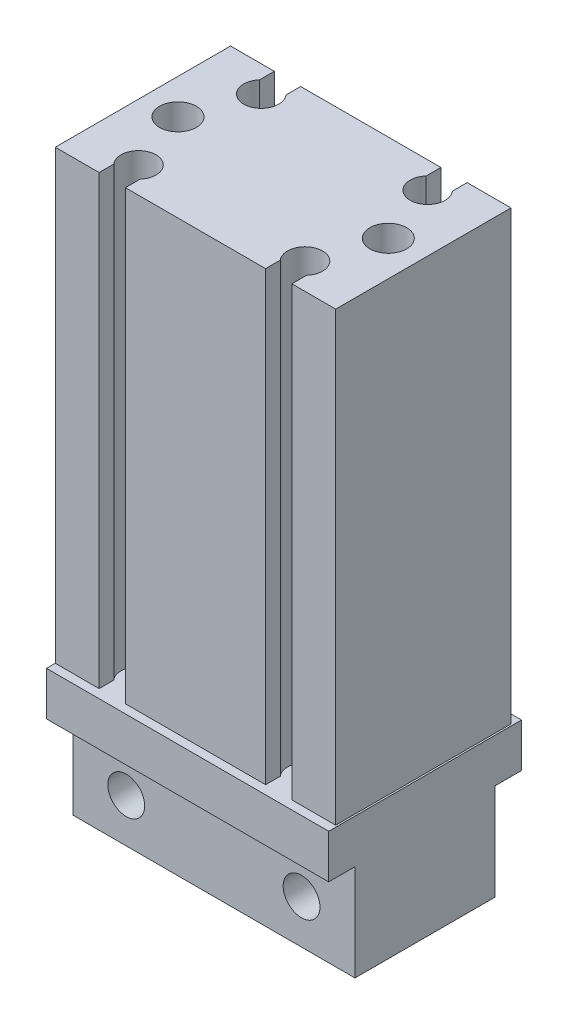
from build123d import *

# Parameters (mm, degrees)
EXTRUDE_1_DEPTH     = 51
EXTRUDE_2_DEPTH     = 32.2
SKETCH_5_R          = 7
CUT_EXTRUDE_3_DEPTH = 4
SKETCH_7_R          = 1.5
CUT_EXTRUDE_4_DEPTH = 8
SKETCH_8_R          = 2.5
CUT_EXTRUDE_5_DEPTH = 50
SKETCH_9_R          = 2.1
CUT_EXTRUDE_6_DEPTH = 57.784152719
SKETCH_10_R         = 2.1
CUT_EXTRUDE_7_DEPTH = 12
SKETCH_11_R         = 2.1
CUT_EXTRUDE_8_DEPTH = 6


with BuildPart() as part:
    # 草图1 → 拉伸1 (new body)
    with BuildSketch(Plane(origin=(0, 0, 0), x_dir=(1, 0, 0), z_dir=(0, 1, 0))):
        with BuildLine():
            Line((-16, -10), (-11, -10))
            Line((-11, -10), (-11, -8.322875656))
            ThreePointArc((-11, -8.322875656), (-9.5, -5), (-8, -8.322875656))
            Line((-8, -8.322875656), (-8, -10))
            Line((-8, -10), (8, -10))
            Line((8, -10), (8, -8.322875656))
            ThreePointArc((8, -8.322875656), (9.5, -5), (11, -8.322875656))
            Line((11, -8.322875656), (11, -10))
            Line((11, -10), (16, -10))
            Line((16, -10), (16, 10))
            Line((16, 10), (11, 10))
            Line((11, 10), (11, 8.322875656))
            ThreePointArc((11, 8.322875656), (9.5, 5), (8, 8.322875656))
            Line((8, 8.322875656), (8, 10))
            Line((8, 10), (-8, 10))
            Line((-8, 10), (-8, 8.322875656))
            ThreePointArc((-8, 8.322875656), (-9.5, 5), (-11, 8.322875656))
            Line((-11, 8.322875656), (-11, 10))
            Line((-11, 10), (-16, 10))
            Line((-16, 10), (-16, -10))
        make_face()
    extrude(amount=EXTRUDE_1_DEPTH)


with BuildPart() as body_2:
    # 草图4 → 拉伸2 (new body)
    with BuildSketch(Plane.ZY.offset(16)):
        Polygon((-11, 0), (-11, -5), (-8, -5), (-8, -16), (8, -16), (8, -5), (11, -5), (11, 0), align=None)
    extrude(amount=-EXTRUDE_2_DEPTH)

    # 草图5 → 拉伸3 (cut)
    with BuildSketch(Plane.XZ.offset(16)):
        with Locations(Location((0, 0, 0), (0, 0, 270))):
            Circle(SKETCH_5_R)
    extrude(amount=-CUT_EXTRUDE_3_DEPTH, mode=Mode.SUBTRACT)

    # 草图7 → 拉伸4 (cut)
    with BuildSketch(Plane.XZ.offset(16)):
        with Locations(Location((-10, 0, 0), (0, 0, 270))):
            Circle(SKETCH_7_R)
        with Locations(Location((10, 0, 0), (0, 0, 270))):
            Circle(SKETCH_7_R)
    extrude(amount=-CUT_EXTRUDE_4_DEPTH, mode=Mode.SUBTRACT)


with BuildPart() as cut_extrude_5_tool:
    # 草图8 → 拉伸5 (new body)
    with BuildSketch(Plane.XZ.offset(12)):
        with Locations(Location((0, 0, 0), (0, 0, 270))):
            Circle(SKETCH_8_R)
    extrude(amount=-CUT_EXTRUDE_5_DEPTH)


with BuildPart() as part_1:
    add(part.part)

    # 拉伸5: cut by cut_extrude_5_tool
    add(cut_extrude_5_tool.part, mode=Mode.SUBTRACT)

    # 草图10 → 拉伸7 (cut)
    with BuildSketch(Plane(origin=(0, 51, 0), x_dir=(1, 0, 0), z_dir=(0, 1, 0))):
        with Locations(Location((12, 0, 0), (0, 0, 270))):
            Circle(SKETCH_10_R)
        with Locations(Location((-12, 0, 0), (0, 0, 270))):
            Circle(SKETCH_10_R)
    extrude(amount=-CUT_EXTRUDE_7_DEPTH, mode=Mode.SUBTRACT)

    # 草图11 → 拉伸8 (cut)
    with BuildSketch(Plane.ZY.offset(16)):
        with Locations((0, 38.5)):
            Circle(SKETCH_11_R)
        with Locations((0, 12.5)):
            Circle(SKETCH_11_R)
    extrude(amount=-CUT_EXTRUDE_8_DEPTH, mode=Mode.SUBTRACT)


with BuildPart() as body_2_1:
    add(body_2.part)

    # 拉伸5: cut by cut_extrude_5_tool
    add(cut_extrude_5_tool.part, mode=Mode.SUBTRACT)

    # 草图9 → 拉伸6 (cut, through all)
    with BuildSketch(Plane.XY.offset(8)):
        with Locations((10.1, -11)):
            Circle(SKETCH_9_R)
        with Locations((-9.9, -11)):
            Circle(SKETCH_9_R)
    extrude(amount=-CUT_EXTRUDE_6_DEPTH, mode=Mode.SUBTRACT)


solid = Compound([part_1.part, body_2_1.part])
